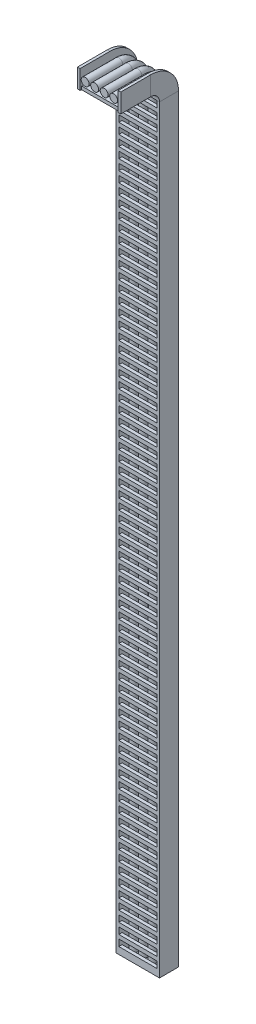
from build123d import *

# Parameters (mm, degrees)
CROQUIS1_W              = 330
CROQUIS1_H              = 145
SALIENTE_EXTRUIR1_DEPTH = 10
CROQUIS3_W              = 290
CROQUIS3_H              = 49.824023127
CORTAR_EXTRUIR1_DEPTH   = 66
MATRIZL1_COUNT          = 73
MATRIZL1_PITCH          = 80
CROQUIS4_W              = 290
CROQUIS4_H              = 34.053667434
CORTAR_EXTRUIR2_DEPTH   = 66
MATRIZL2_COUNT          = 4
MATRIZL2_PITCH          = 80
CROQUIS5_R              = 30


with BuildPart() as part:
    # Croquis1 → Saliente-Extruir1 (new body)
    with BuildSketch(Plane(origin=(0, 0, 0), x_dir=(1, 0, 0), z_dir=(0, 1, 0))):
        Rectangle(CROQUIS1_W, CROQUIS1_H)
    extrude(amount=SALIENTE_EXTRUIR1_DEPTH)

    # Barrer1: sweep along a curve in space
    with BuildLine() as barrer1_path:
        Line((0, 0, 0), (0, 5782.5, 0))
        ThreePointArc((0, 5782.5, 0), (0, 5881.494949366, 41.005050634), (0, 5922.5, 140))
        Line((0, 5922.5, 140), (0, 5922.5, 367.5))
    # Croquis2 → Barrer1 (sweep)
    with BuildSketch(Plane(origin=(0, 10, 0), x_dir=(1, 0, 0), z_dir=(0, 1, 0))):
        Polygon((-165, -72.5), (165, -72.5), (165, 72.5), (145, 72.5), (145, -47.5), (-145, -47.5), (-145, 72.5), (-165, 72.5), align=None)
    sweep(path=barrer1_path.line)

    # Croquis3 → Cortar-Extruir1 (cut)
    with BuildSketch(Plane(origin=(0, 0, 47.5), x_dir=(-1, 0, 0), z_dir=(0, 0, -1))):
        with Locations((0, 77.661889235)):
            Rectangle(CROQUIS3_W, CROQUIS3_H)
    cortar_extruir1 = extrude(amount=-CORTAR_EXTRUIR1_DEPTH, mode=Mode.SUBTRACT)

    # MatrizL1: Cortar-Extruir1 ×73
    with Locations(*[(0, i * MATRIZL1_PITCH, 0) for i in range(1, MATRIZL1_COUNT)]):
        add(cortar_extruir1, mode=Mode.SUBTRACT)

    # Croquis4 → Cortar-Extruir2 (cut)
    with BuildSketch(Plane(origin=(0, 5875, 0), x_dir=(1, 0, 0), z_dir=(0, 1, 0))):
        with Locations((0, -133.87289015)):
            Rectangle(CROQUIS4_W, CROQUIS4_H)
    cortar_extruir2 = extrude(amount=-CORTAR_EXTRUIR2_DEPTH, mode=Mode.SUBTRACT)

    # MatrizL2: Cortar-Extruir2 ×4
    with Locations(*[(0, 0, i * MATRIZL2_PITCH) for i in range(1, MATRIZL2_COUNT)]):
        add(cortar_extruir2, mode=Mode.SUBTRACT)

    # Barrer2: sweep along a curve in space
    with BuildLine() as barrer2_path:
        Line((107.956621207, 10, -12.49999262), (107.956621207, 5803.62815775, -12.49999262))
        ThreePointArc((107.956621207, 5803.62815775, -12.49999262), (107.956621207, 5888.480971492, 22.647193638), (107.956621207, 5923.62815775, 107.50000738))
        Line((107.956621207, 5923.62815775, 107.50000738), (107.956621207, 5923.62815775, 364.784238388))
    # Croquis5 → Barrer2 (sweep)
    with BuildSketch(Plane(origin=(0, 10, 0), x_dir=(1, 0, 0), z_dir=(0, 1, 0))):
        with Locations((107.956621207, 12.49999262)):
            Circle(CROQUIS5_R)
        with Locations((35.456621207, 12.49999262)):
            Circle(CROQUIS5_R)
        with Locations((-109.543378793, 12.49999262)):
            Circle(CROQUIS5_R)
        with Locations((-37.043378793, 12.49999262)):
            Circle(CROQUIS5_R)
    sweep(path=barrer2_path.line)


solid = part.part
